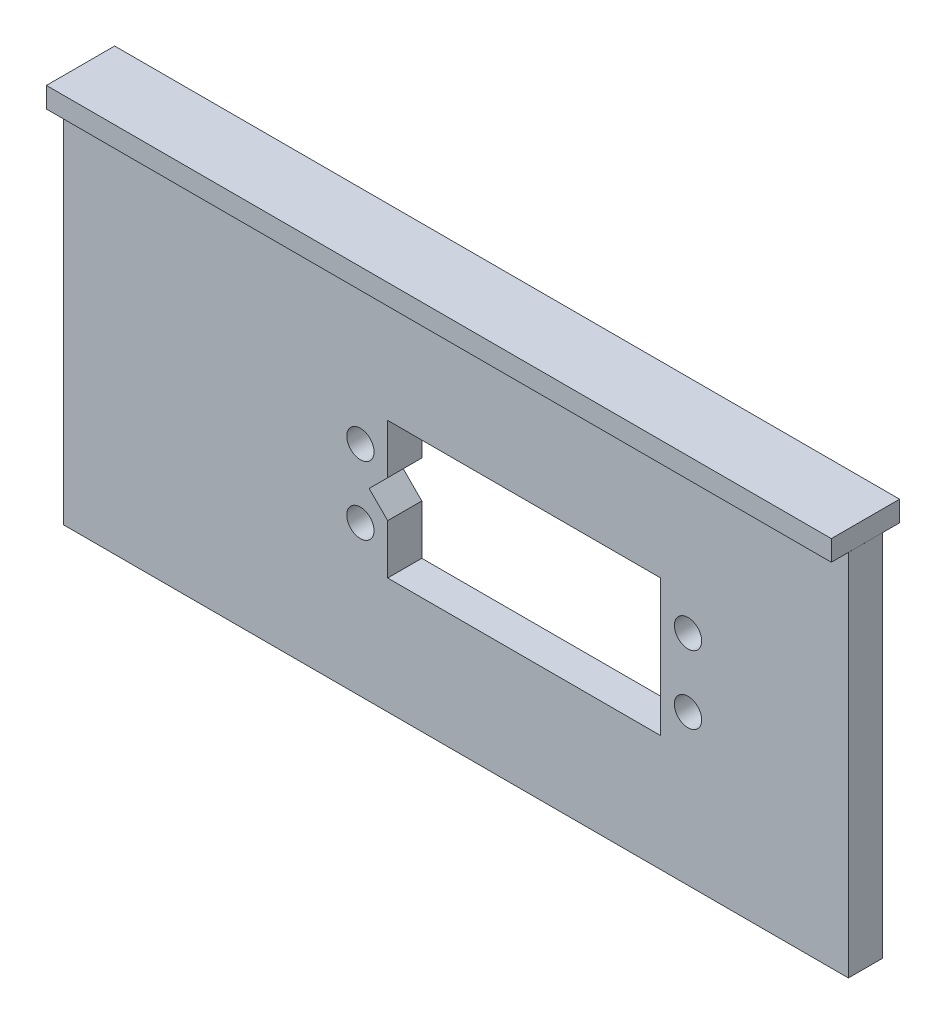
from build123d import *

# Parameters (mm, degrees)
SKETCH_1_W          = 115
SKETCH_1_H          = 54
SKETCH_1_R          = 2
SKETCH_1_W_2        = 40
SKETCH_1_H_2        = 20
EXTRUDE_3_DEPTH     = 5
SKETCH_3_R          = 1.75
CUT_EXTRUDE_2_DEPTH = 15
CUT_EXTRUDE_3_DEPTH = 10
EXTRUDE_4_DEPTH     = 3


with BuildPart() as part:
    # 草圖1 → 填料-伸長3 (new body)
    with BuildSketch(Plane.XY):
        with Locations((13.062480584, -3.484099434)):
            Rectangle(SKETCH_1_W, SKETCH_1_H)
        with Locations((-0.937519416, -8.484099434)):
            Circle(SKETCH_1_R, mode=Mode.SUBTRACT)
        with Locations((47.062480584, -8.484099434)):
            Circle(SKETCH_1_R, mode=Mode.SUBTRACT)
        with Locations((-0.937519416, 1.515900566)):
            Circle(SKETCH_1_R, mode=Mode.SUBTRACT)
        with Locations((47.062480584, 1.515900566)):
            Circle(SKETCH_1_R, mode=Mode.SUBTRACT)
        with Locations((23.062480584, -3.484099434)):
            Rectangle(SKETCH_1_W_2, SKETCH_1_H_2, mode=Mode.SUBTRACT)
    extrude(amount=EXTRUDE_3_DEPTH)

    # 草圖3 → 除料-伸長2 (cut)
    with BuildSketch(Plane.XZ.offset(30.484099434)):
        with Locations(Location((29.062480584, 2.5, 0), (0, 0, 270))):
            Circle(SKETCH_3_R)
        with Locations(Location((-2.937519416, 2.5, 0), (0, 0, 270))):
            Circle(SKETCH_3_R)
    extrude(amount=-CUT_EXTRUDE_2_DEPTH, mode=Mode.SUBTRACT)

    # 草圖4 → 除料-伸長3 (cut)
    with BuildSketch(Plane.XY.offset(5)):
        Polygon((0.340707034, -3.484099434), (3.062480584, -6.205872984), (3.062480584, -0.762325884), align=None)
    extrude(amount=-CUT_EXTRUDE_3_DEPTH, mode=Mode.SUBTRACT)

    # 草圖5 → 填料-伸長4 (add)
    with BuildSketch(Plane(origin=(0, 23.515900566, 0), x_dir=(1, 0, 0), z_dir=(0, 1, 0))):
        Polygon((-44.437519416, 0), (-44.437519416, 2.5), (70.560278635, 2.5), (70.560278635, -7.5), (-44.437519416, -7.5), align=None)
    extrude(amount=EXTRUDE_4_DEPTH)


solid = part.part
